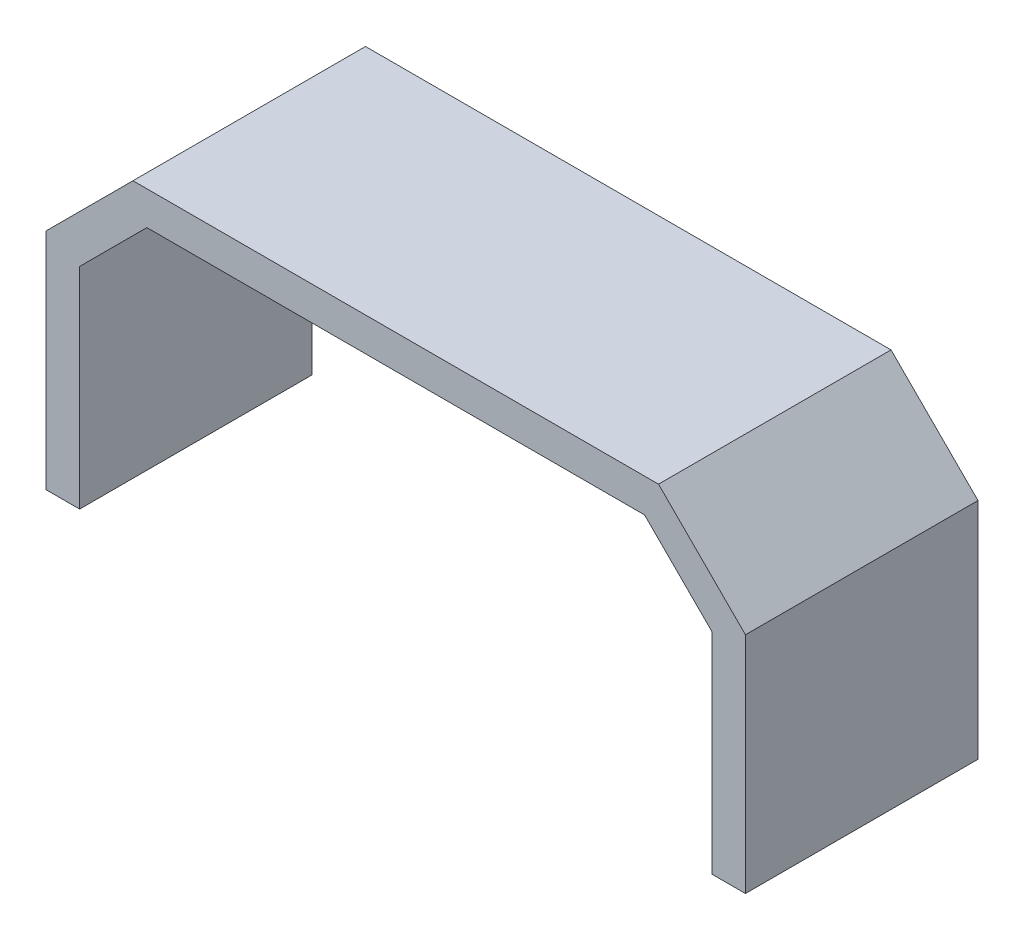
from build123d import *

# Parameters (mm, degrees)
EXTRUDE_1_DEPTH = 34.575


with BuildPart() as part:
    # Эскиз1 → Бобышка-Вытянуть1 (new body)
    with BuildSketch(Plane.XY):
        Polygon((-47, 0), (-47, 31.248932188), (-37, 41.248932188), (37, 41.248932188), (47, 31.248932188), (47, 0), (52, 0), (52, 33.32), (39.071067812, 46.248932188), (-39.071067812, 46.248932188), (-52, 33.32), (-52, 0), align=None)
    extrude(amount=EXTRUDE_1_DEPTH)


solid = part.part
